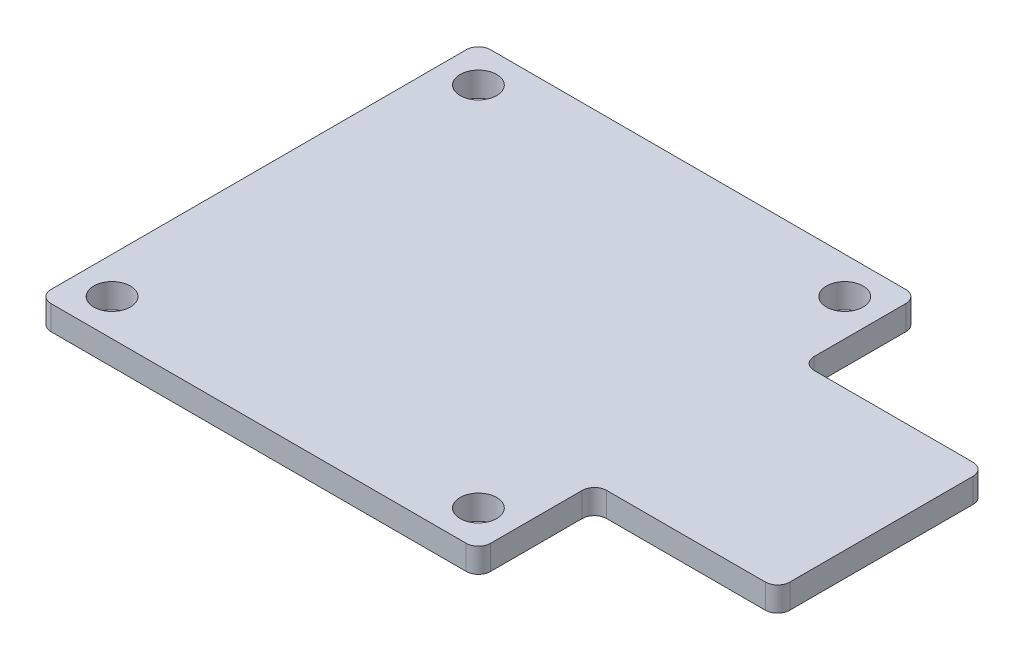
from build123d import *

# Parameters (mm, degrees)
SKETCH1_W           = 36
SKETCH1_H           = 36
SKETCH1_R           = 1.5
SKETCH1_W_2         = 15
SKETCH1_H_2         = 17
BOSS_EXTRUDE1_DEPTH = 2
FILLET1_R           = 1


with BuildPart() as part:
    # Sketch1 → Boss-Extrude1 (new body)
    # profile 1 of 2: a face of its own
    with BuildSketch(Plane(origin=(0, 0, 0), x_dir=(1, 0, 0), z_dir=(0, 1, 0))):
        with Locations((18, 18)):
            Rectangle(SKETCH1_W, SKETCH1_H)
        with Locations(Location((33, 3, 0), (0, 0, 270))):
            Circle(SKETCH1_R, mode=Mode.SUBTRACT)
        with Locations(Location((3, 3, 0), (0, 0, 270))):
            Circle(SKETCH1_R, mode=Mode.SUBTRACT)
        with Locations(Location((33, 33, 0), (0, 0, 270))):
            Circle(SKETCH1_R, mode=Mode.SUBTRACT)
        with Locations(Location((3, 33, 0), (0, 0, 270))):
            Circle(SKETCH1_R, mode=Mode.SUBTRACT)
    # profile 2 of 2: a face of its own
    with BuildSketch(Plane(origin=(0, 0, 0), x_dir=(1, 0, 0), z_dir=(0, 1, 0))):
        with Locations((43.5, 18)):
            Rectangle(SKETCH1_W_2, SKETCH1_H_2)
    extrude(amount=BOSS_EXTRUDE1_DEPTH)

    # Fillet1
    fillet1_edges = [part.edges().sort_by_distance(p)[0] for p in [
        (0, 1, 0),
        (0, 1, -36),
        (36, 1, -36),
        (36, 1, -26.5),
        (51, 1, -26.5),
        (51, 1, -9.5),
        (36, 1, -9.5),
        (36, 1, 0),
    ]]
    fillet(fillet1_edges, radius=FILLET1_R)


solid = part.part
